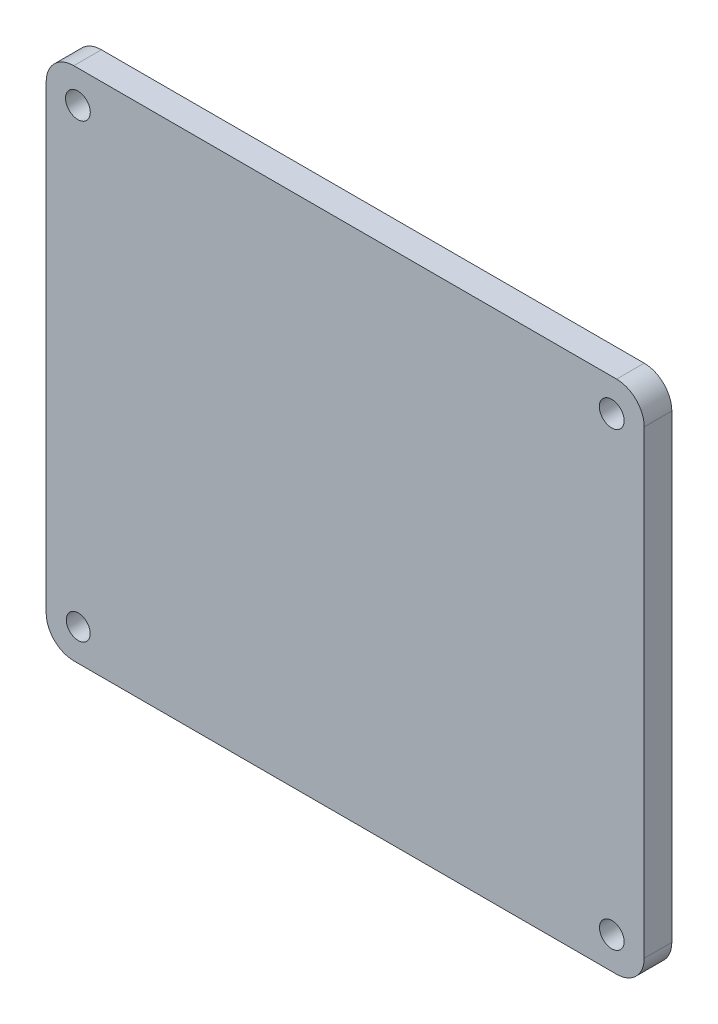
from build123d import *

# Parameters (mm, degrees)
ESQUISSE1_R        = 1.345345221
ESQUISSE1_R_2      = 1.346909221
ESQUISSE1_R_3      = 1.298611316
ESQUISSE1_R_4      = 1.335683761
BOSS_EXTRU_1_DEPTH = 3


with BuildPart() as part:
    # Esquisse1 → Boss.-Extru.1 (new body)
    with BuildSketch(Plane.XY):
        with BuildLine():
            Line((142.914343154, 306.333520822), (201.871913252, 306.333520822))
            ThreePointArc((201.871913252, 306.333520822), (203.993233595, 305.454841166), (204.871913252, 303.333520822))
            Line((204.871913252, 303.333520822), (204.871913252, 253.348131253))
            ThreePointArc((204.871913252, 253.348131253), (203.993233595, 251.22681091), (201.871913252, 250.348131253))
            Line((201.871913252, 250.348131253), (142.914343154, 250.348131253))
            ThreePointArc((142.914343154, 250.348131253), (140.793022811, 251.22681091), (139.914343154, 253.348131253))
            Line((139.914343154, 253.348131253), (139.914343154, 303.333520822))
            ThreePointArc((139.914343154, 303.333520822), (140.793022811, 305.454841166), (142.914343154, 306.333520822))
        make_face()
        with Locations((143.360544481, 302.831604494)):
            Circle(ESQUISSE1_R, mode=Mode.SUBTRACT)
        with Locations((201.344684378, 302.818633302)):
            Circle(ESQUISSE1_R_2, mode=Mode.SUBTRACT)
        with Locations((143.395469299, 253.802031827)):
            Circle(ESQUISSE1_R_3, mode=Mode.SUBTRACT)
        with Locations((201.354862046, 253.815125268)):
            Circle(ESQUISSE1_R_4, mode=Mode.SUBTRACT)
    extrude(amount=BOSS_EXTRU_1_DEPTH)


solid = part.part
